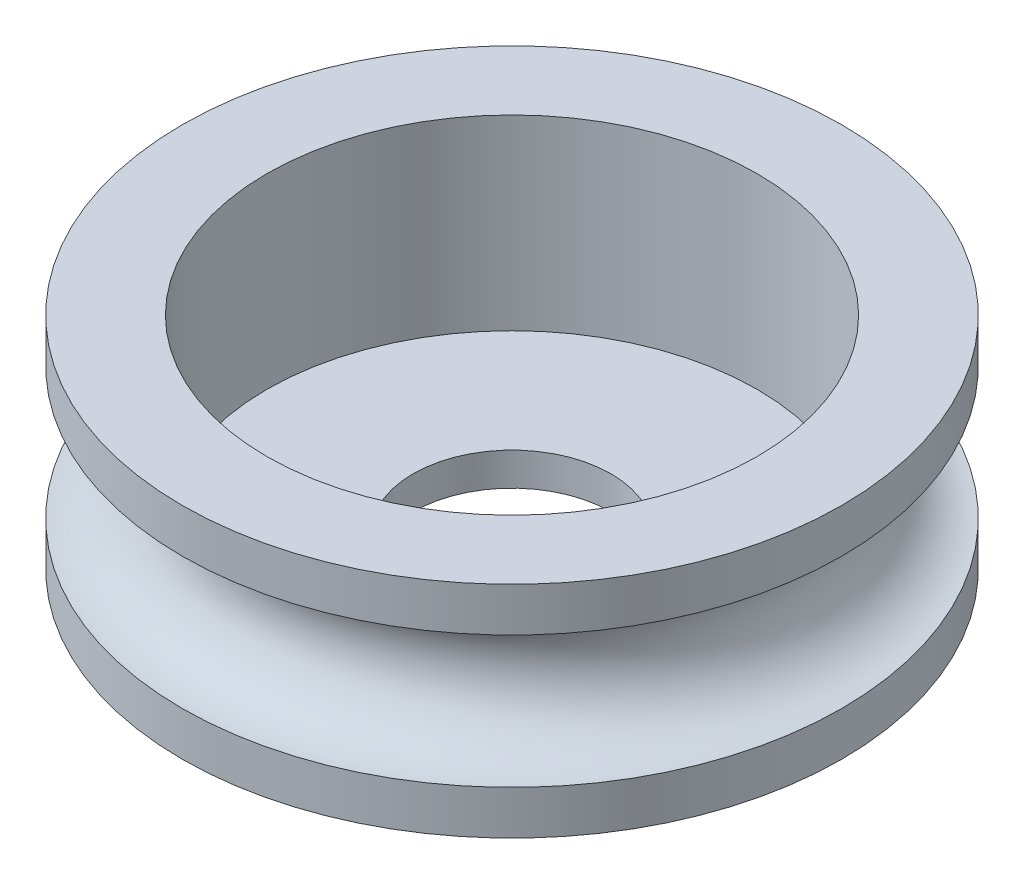
from build123d import *

# Parameters (mm, degrees)
ESBO_O1_R                = 15
RESSALTO_EXTRUS_O1_DEPTH = 10
ESBO_O9_R                = 11.15
CORTE_EXTRUS_O1_DEPTH    = 8.5
ESBO_O10_R               = 4.5
CORTE_EXTRUS_O2_DEPTH    = 24.452078799


with BuildPart() as part:
    # Esboço1 → Ressalto-extrusão1 (new body)
    with BuildSketch(Plane(origin=(0, 0, 0), x_dir=(1, 0, 0), z_dir=(0, 1, 0))):
        with Locations(Location((0, 0, 0), (0, 0, 270))):
            Circle(ESBO_O1_R)
    extrude(amount=RESSALTO_EXTRUS_O1_DEPTH)

    # Esboço8 → Corte-Revolução1 (revolve, cut)
    with BuildSketch(Plane.XY, mode=Mode.PRIVATE) as corte_revolu_o1_sk:
        with BuildLine():
            Line((15, 8), (15, 2))
            ThreePointArc((15, 2), (12, 5), (15, 8))
        make_face()
    revolve(corte_revolu_o1_sk.sketch.rotate(Axis((0, 0, 0), (0, 1, 0)), 90), axis=Axis((0, 0, 0), (0, 1, 0)), mode=Mode.SUBTRACT)

    # Esboço9 → Corte-extrusão1 (cut)
    with BuildSketch(Plane(origin=(0, 10, 0), x_dir=(1, 0, 0), z_dir=(0, 1, 0))):
        with Locations(Location((0, 0, 0), (0, 0, 270))):
            Circle(ESBO_O9_R)
    extrude(amount=-CORTE_EXTRUS_O1_DEPTH, mode=Mode.SUBTRACT)

    # Esboço10 → Corte-extrusão2 (cut, through all)
    with BuildSketch(Plane.XZ):
        with Locations(Location((0, 0, 0), (0, 0, 270))):
            Circle(ESBO_O10_R)
    extrude(amount=-CORTE_EXTRUS_O2_DEPTH, mode=Mode.SUBTRACT)


solid = part.part
